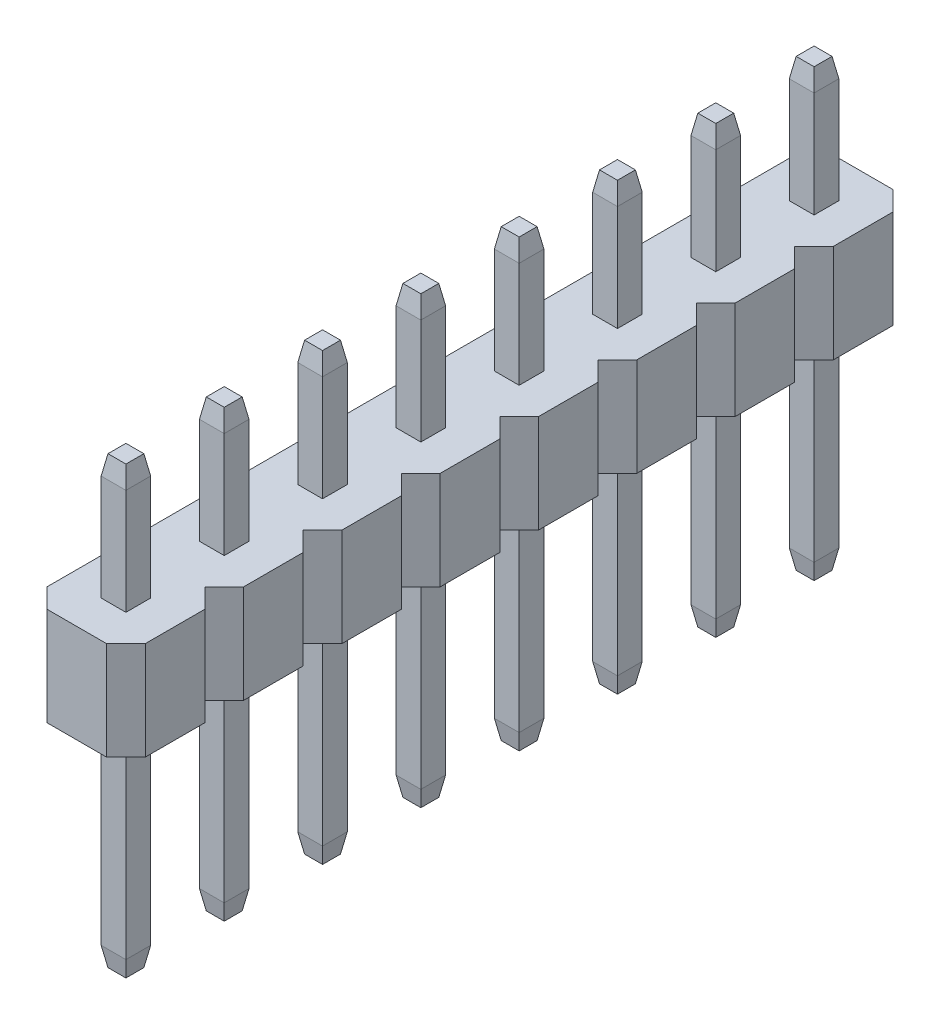
from build123d import *
from OCP.BRepFilletAPI import BRepFilletAPI_MakeChamfer

# Parameters (mm, degrees)
BOSS_EXTRUDE1_DEPTH         = 1.27
BOSS_EXTRUDE2_START         = -7
SKETCH2_W                   = 0.64
SKETCH2_H                   = 0.64
BOSS_EXTRUDE2_DEPTH         = 11.5
CHAMFER1_SIZE               = 0.5
CHAMFER1_SIZE2              = 0.08816349
LPATTERN1_COUNT             = 8
LPATTERN1_PITCH             = 2.54
CHAMFER1_OF_LPATTERN1_SIZE  = 0.5
CHAMFER1_OF_LPATTERN1_SIZE2 = 0.08816349


with BuildPart() as part:
    # Sketch1 → Boss-Extrude1 (new, symmetric)
    with BuildSketch(Plane(origin=(0, 0, 0), x_dir=(1, 0, 0), z_dir=(0, 1, 0))):
        Polygon((-0.77, -1.27), (-1.27, -0.77), (-1.27, 0.77), (-0.77, 1.27), (0.77, 1.27), (1.27, 0.77), (1.27, -0.77), (0.77, -1.27), align=None)
    boss_extrude1 = extrude(amount=BOSS_EXTRUDE1_DEPTH, both=True)

    # Sketch2 → Boss-Extrude2 (add)
    with BuildSketch(Plane(origin=(0, 0, 0), x_dir=(1, 0, 0), z_dir=(0, 1, 0)).offset(BOSS_EXTRUDE2_START)):
        Rectangle(SKETCH2_W, SKETCH2_H)
    boss_extrude2 = extrude(amount=BOSS_EXTRUDE2_DEPTH)

    # Chamfer1: one chamfer whose edges measure the first distance from different faces: ONE call of the kernel's chamfer builder (chamfer() names one face for all edges)
    chamfer1_edges_1 = [part.edges().sort_by_distance(p)[0] for p in [
        (-0.32, -7, 0),
    ]]
    chamfer1_side_1 = [part.faces().sort_by_distance(p)[0] for p in [
        (-0.32, -4.135, 0),
    ]]
    chamfer1_edges_2 = [part.edges().sort_by_distance(p)[0] for p in [
        (0, -7, -0.32),
    ]]
    chamfer1_side_2 = [part.faces().sort_by_distance(p)[0] for p in [
        (0, -4.135, -0.32),
    ]]
    chamfer1_edges_3 = [part.edges().sort_by_distance(p)[0] for p in [
        (0.32, -7, 0),
    ]]
    chamfer1_side_3 = [part.faces().sort_by_distance(p)[0] for p in [
        (0.32, -4.135, 0),
    ]]
    chamfer1_edges_4 = [part.edges().sort_by_distance(p)[0] for p in [
        (0, -7, 0.32),
    ]]
    chamfer1_side_4 = [part.faces().sort_by_distance(p)[0] for p in [
        (0, -4.135, 0.32),
    ]]
    chamfer1_edges_5 = [part.edges().sort_by_distance(p)[0] for p in [
        (-0.32, 4.5, 0),
    ]]
    chamfer1_side_5 = [part.faces().sort_by_distance(p)[0] for p in [
        (-0.32, 2.885, 0),
    ]]
    chamfer1_edges_6 = [part.edges().sort_by_distance(p)[0] for p in [
        (0, 4.5, 0.32),
    ]]
    chamfer1_side_6 = [part.faces().sort_by_distance(p)[0] for p in [
        (0, 2.885, 0.32),
    ]]
    chamfer1_edges_7 = [part.edges().sort_by_distance(p)[0] for p in [
        (0.32, 4.5, 0),
    ]]
    chamfer1_side_7 = [part.faces().sort_by_distance(p)[0] for p in [
        (0.32, 2.885, 0),
    ]]
    chamfer1_edges_8 = [part.edges().sort_by_distance(p)[0] for p in [
        (0, 4.5, -0.32),
    ]]
    chamfer1_side_8 = [part.faces().sort_by_distance(p)[0] for p in [
        (0, 2.885, -0.32),
    ]]
    chamfer1 = BRepFilletAPI_MakeChamfer(part.part.solid().wrapped)
    for e in chamfer1_edges_1:
        chamfer1.Add(CHAMFER1_SIZE, CHAMFER1_SIZE2, e.wrapped, chamfer1_side_1[0].wrapped)  # the first distance lies on this face
    for e in chamfer1_edges_2:
        chamfer1.Add(CHAMFER1_SIZE, CHAMFER1_SIZE2, e.wrapped, chamfer1_side_2[0].wrapped)  # the first distance lies on this face
    for e in chamfer1_edges_3:
        chamfer1.Add(CHAMFER1_SIZE, CHAMFER1_SIZE2, e.wrapped, chamfer1_side_3[0].wrapped)  # the first distance lies on this face
    for e in chamfer1_edges_4:
        chamfer1.Add(CHAMFER1_SIZE, CHAMFER1_SIZE2, e.wrapped, chamfer1_side_4[0].wrapped)  # the first distance lies on this face
    for e in chamfer1_edges_5:
        chamfer1.Add(CHAMFER1_SIZE, CHAMFER1_SIZE2, e.wrapped, chamfer1_side_5[0].wrapped)  # the first distance lies on this face
    for e in chamfer1_edges_6:
        chamfer1.Add(CHAMFER1_SIZE, CHAMFER1_SIZE2, e.wrapped, chamfer1_side_6[0].wrapped)  # the first distance lies on this face
    for e in chamfer1_edges_7:
        chamfer1.Add(CHAMFER1_SIZE, CHAMFER1_SIZE2, e.wrapped, chamfer1_side_7[0].wrapped)  # the first distance lies on this face
    for e in chamfer1_edges_8:
        chamfer1.Add(CHAMFER1_SIZE, CHAMFER1_SIZE2, e.wrapped, chamfer1_side_8[0].wrapped)  # the first distance lies on this face
    add(Compound.cast(chamfer1.Shape()), mode=Mode.REPLACE)

    # LPattern1: Boss-Extrude1, Boss-Extrude2 ×8
    with Locations(*[(0, 0, -i * LPATTERN1_PITCH) for i in range(1, LPATTERN1_COUNT)]):
        add(boss_extrude1)
        add(boss_extrude2)

    # Chamfer1 of LPattern1: one chamfer whose edges measure the first distance from different faces: ONE call of the kernel's chamfer builder (chamfer() names one face for all edges)
    chamfer1_of_lpattern1_edges_1 = [part.edges().sort_by_distance(p)[0] for p in [
        (-0.32, -7, -2.54),
    ]]
    chamfer1_of_lpattern1_side_1 = [part.faces().sort_by_distance(p)[0] for p in [
        (-0.32, -4.135, -2.54),
    ]]
    chamfer1_of_lpattern1_edges_2 = [part.edges().sort_by_distance(p)[0] for p in [
        (0, -7, -2.86),
    ]]
    chamfer1_of_lpattern1_side_2 = [part.faces().sort_by_distance(p)[0] for p in [
        (0, -4.135, -2.86),
    ]]
    chamfer1_of_lpattern1_edges_3 = [part.edges().sort_by_distance(p)[0] for p in [
        (0.32, -7, -2.54),
    ]]
    chamfer1_of_lpattern1_side_3 = [part.faces().sort_by_distance(p)[0] for p in [
        (0.32, -4.135, -2.54),
    ]]
    chamfer1_of_lpattern1_edges_4 = [part.edges().sort_by_distance(p)[0] for p in [
        (0, -7, -2.22),
    ]]
    chamfer1_of_lpattern1_side_4 = [part.faces().sort_by_distance(p)[0] for p in [
        (0, -4.135, -2.22),
    ]]
    chamfer1_of_lpattern1_edges_5 = [part.edges().sort_by_distance(p)[0] for p in [
        (-0.32, 4.5, -2.54),
    ]]
    chamfer1_of_lpattern1_side_5 = [part.faces().sort_by_distance(p)[0] for p in [
        (-0.32, 2.885, -2.54),
    ]]
    chamfer1_of_lpattern1_edges_6 = [part.edges().sort_by_distance(p)[0] for p in [
        (0, 4.5, -2.22),
    ]]
    chamfer1_of_lpattern1_side_6 = [part.faces().sort_by_distance(p)[0] for p in [
        (0, 2.885, -2.22),
    ]]
    chamfer1_of_lpattern1_edges_7 = [part.edges().sort_by_distance(p)[0] for p in [
        (0.32, 4.5, -2.54),
    ]]
    chamfer1_of_lpattern1_side_7 = [part.faces().sort_by_distance(p)[0] for p in [
        (0.32, 2.885, -2.54),
    ]]
    chamfer1_of_lpattern1_edges_8 = [part.edges().sort_by_distance(p)[0] for p in [
        (0, 4.5, -2.86),
    ]]
    chamfer1_of_lpattern1_side_8 = [part.faces().sort_by_distance(p)[0] for p in [
        (0, 2.885, -2.86),
    ]]
    chamfer1_of_lpattern1_edges_9 = [part.edges().sort_by_distance(p)[0] for p in [
        (-0.32, -7, -5.08),
    ]]
    chamfer1_of_lpattern1_side_9 = [part.faces().sort_by_distance(p)[0] for p in [
        (-0.32, -4.135, -5.08),
    ]]
    chamfer1_of_lpattern1_edges_10 = [part.edges().sort_by_distance(p)[0] for p in [
        (0, -7, -5.4),
    ]]
    chamfer1_of_lpattern1_side_10 = [part.faces().sort_by_distance(p)[0] for p in [
        (0, -4.135, -5.4),
    ]]
    chamfer1_of_lpattern1_edges_11 = [part.edges().sort_by_distance(p)[0] for p in [
        (0.32, -7, -5.08),
    ]]
    chamfer1_of_lpattern1_side_11 = [part.faces().sort_by_distance(p)[0] for p in [
        (0.32, -4.135, -5.08),
    ]]
    chamfer1_of_lpattern1_edges_12 = [part.edges().sort_by_distance(p)[0] for p in [
        (0, -7, -4.76),
    ]]
    chamfer1_of_lpattern1_side_12 = [part.faces().sort_by_distance(p)[0] for p in [
        (0, -4.135, -4.76),
    ]]
    chamfer1_of_lpattern1_edges_13 = [part.edges().sort_by_distance(p)[0] for p in [
        (-0.32, 4.5, -5.08),
    ]]
    chamfer1_of_lpattern1_side_13 = [part.faces().sort_by_distance(p)[0] for p in [
        (-0.32, 2.885, -5.08),
    ]]
    chamfer1_of_lpattern1_edges_14 = [part.edges().sort_by_distance(p)[0] for p in [
        (0, 4.5, -4.76),
    ]]
    chamfer1_of_lpattern1_side_14 = [part.faces().sort_by_distance(p)[0] for p in [
        (0, 2.885, -4.76),
    ]]
    chamfer1_of_lpattern1_edges_15 = [part.edges().sort_by_distance(p)[0] for p in [
        (0.32, 4.5, -5.08),
    ]]
    chamfer1_of_lpattern1_side_15 = [part.faces().sort_by_distance(p)[0] for p in [
        (0.32, 2.885, -5.08),
    ]]
    chamfer1_of_lpattern1_edges_16 = [part.edges().sort_by_distance(p)[0] for p in [
        (0, 4.5, -5.4),
    ]]
    chamfer1_of_lpattern1_side_16 = [part.faces().sort_by_distance(p)[0] for p in [
        (0, 2.885, -5.4),
    ]]
    chamfer1_of_lpattern1_edges_17 = [part.edges().sort_by_distance(p)[0] for p in [
        (-0.32, -7, -7.62),
    ]]
    chamfer1_of_lpattern1_side_17 = [part.faces().sort_by_distance(p)[0] for p in [
        (-0.32, -4.135, -7.62),
    ]]
    chamfer1_of_lpattern1_edges_18 = [part.edges().sort_by_distance(p)[0] for p in [
        (0, -7, -7.94),
    ]]
    chamfer1_of_lpattern1_side_18 = [part.faces().sort_by_distance(p)[0] for p in [
        (0, -4.135, -7.94),
    ]]
    chamfer1_of_lpattern1_edges_19 = [part.edges().sort_by_distance(p)[0] for p in [
        (0.32, -7, -7.62),
    ]]
    chamfer1_of_lpattern1_side_19 = [part.faces().sort_by_distance(p)[0] for p in [
        (0.32, -4.135, -7.62),
    ]]
    chamfer1_of_lpattern1_edges_20 = [part.edges().sort_by_distance(p)[0] for p in [
        (0, -7, -7.3),
    ]]
    chamfer1_of_lpattern1_side_20 = [part.faces().sort_by_distance(p)[0] for p in [
        (0, -4.135, -7.3),
    ]]
    chamfer1_of_lpattern1_edges_21 = [part.edges().sort_by_distance(p)[0] for p in [
        (-0.32, 4.5, -7.62),
    ]]
    chamfer1_of_lpattern1_side_21 = [part.faces().sort_by_distance(p)[0] for p in [
        (-0.32, 2.885, -7.62),
    ]]
    chamfer1_of_lpattern1_edges_22 = [part.edges().sort_by_distance(p)[0] for p in [
        (0, 4.5, -7.3),
    ]]
    chamfer1_of_lpattern1_side_22 = [part.faces().sort_by_distance(p)[0] for p in [
        (0, 2.885, -7.3),
    ]]
    chamfer1_of_lpattern1_edges_23 = [part.edges().sort_by_distance(p)[0] for p in [
        (0.32, 4.5, -7.62),
    ]]
    chamfer1_of_lpattern1_side_23 = [part.faces().sort_by_distance(p)[0] for p in [
        (0.32, 2.885, -7.62),
    ]]
    chamfer1_of_lpattern1_edges_24 = [part.edges().sort_by_distance(p)[0] for p in [
        (0, 4.5, -7.94),
    ]]
    chamfer1_of_lpattern1_side_24 = [part.faces().sort_by_distance(p)[0] for p in [
        (0, 2.885, -7.94),
    ]]
    chamfer1_of_lpattern1_edges_25 = [part.edges().sort_by_distance(p)[0] for p in [
        (-0.32, -7, -10.16),
    ]]
    chamfer1_of_lpattern1_side_25 = [part.faces().sort_by_distance(p)[0] for p in [
        (-0.32, -4.135, -10.16),
    ]]
    chamfer1_of_lpattern1_edges_26 = [part.edges().sort_by_distance(p)[0] for p in [
        (0, -7, -10.48),
    ]]
    chamfer1_of_lpattern1_side_26 = [part.faces().sort_by_distance(p)[0] for p in [
        (0, -4.135, -10.48),
    ]]
    chamfer1_of_lpattern1_edges_27 = [part.edges().sort_by_distance(p)[0] for p in [
        (0.32, -7, -10.16),
    ]]
    chamfer1_of_lpattern1_side_27 = [part.faces().sort_by_distance(p)[0] for p in [
        (0.32, -4.135, -10.16),
    ]]
    chamfer1_of_lpattern1_edges_28 = [part.edges().sort_by_distance(p)[0] for p in [
        (0, -7, -9.84),
    ]]
    chamfer1_of_lpattern1_side_28 = [part.faces().sort_by_distance(p)[0] for p in [
        (0, -4.135, -9.84),
    ]]
    chamfer1_of_lpattern1_edges_29 = [part.edges().sort_by_distance(p)[0] for p in [
        (-0.32, 4.5, -10.16),
    ]]
    chamfer1_of_lpattern1_side_29 = [part.faces().sort_by_distance(p)[0] for p in [
        (-0.32, 2.885, -10.16),
    ]]
    chamfer1_of_lpattern1_edges_30 = [part.edges().sort_by_distance(p)[0] for p in [
        (0, 4.5, -9.84),
    ]]
    chamfer1_of_lpattern1_side_30 = [part.faces().sort_by_distance(p)[0] for p in [
        (0, 2.885, -9.84),
    ]]
    chamfer1_of_lpattern1_edges_31 = [part.edges().sort_by_distance(p)[0] for p in [
        (0.32, 4.5, -10.16),
    ]]
    chamfer1_of_lpattern1_side_31 = [part.faces().sort_by_distance(p)[0] for p in [
        (0.32, 2.885, -10.16),
    ]]
    chamfer1_of_lpattern1_edges_32 = [part.edges().sort_by_distance(p)[0] for p in [
        (0, 4.5, -10.48),
    ]]
    chamfer1_of_lpattern1_side_32 = [part.faces().sort_by_distance(p)[0] for p in [
        (0, 2.885, -10.48),
    ]]
    chamfer1_of_lpattern1_edges_33 = [part.edges().sort_by_distance(p)[0] for p in [
        (-0.32, -7, -12.7),
    ]]
    chamfer1_of_lpattern1_side_33 = [part.faces().sort_by_distance(p)[0] for p in [
        (-0.32, -4.135, -12.7),
    ]]
    chamfer1_of_lpattern1_edges_34 = [part.edges().sort_by_distance(p)[0] for p in [
        (0, -7, -13.02),
    ]]
    chamfer1_of_lpattern1_side_34 = [part.faces().sort_by_distance(p)[0] for p in [
        (0, -4.135, -13.02),
    ]]
    chamfer1_of_lpattern1_edges_35 = [part.edges().sort_by_distance(p)[0] for p in [
        (0.32, -7, -12.7),
    ]]
    chamfer1_of_lpattern1_side_35 = [part.faces().sort_by_distance(p)[0] for p in [
        (0.32, -4.135, -12.7),
    ]]
    chamfer1_of_lpattern1_edges_36 = [part.edges().sort_by_distance(p)[0] for p in [
        (0, -7, -12.38),
    ]]
    chamfer1_of_lpattern1_side_36 = [part.faces().sort_by_distance(p)[0] for p in [
        (0, -4.135, -12.38),
    ]]
    chamfer1_of_lpattern1_edges_37 = [part.edges().sort_by_distance(p)[0] for p in [
        (-0.32, 4.5, -12.7),
    ]]
    chamfer1_of_lpattern1_side_37 = [part.faces().sort_by_distance(p)[0] for p in [
        (-0.32, 2.885, -12.7),
    ]]
    chamfer1_of_lpattern1_edges_38 = [part.edges().sort_by_distance(p)[0] for p in [
        (0, 4.5, -12.38),
    ]]
    chamfer1_of_lpattern1_side_38 = [part.faces().sort_by_distance(p)[0] for p in [
        (0, 2.885, -12.38),
    ]]
    chamfer1_of_lpattern1_edges_39 = [part.edges().sort_by_distance(p)[0] for p in [
        (0.32, 4.5, -12.7),
    ]]
    chamfer1_of_lpattern1_side_39 = [part.faces().sort_by_distance(p)[0] for p in [
        (0.32, 2.885, -12.7),
    ]]
    chamfer1_of_lpattern1_edges_40 = [part.edges().sort_by_distance(p)[0] for p in [
        (0, 4.5, -13.02),
    ]]
    chamfer1_of_lpattern1_side_40 = [part.faces().sort_by_distance(p)[0] for p in [
        (0, 2.885, -13.02),
    ]]
    chamfer1_of_lpattern1_edges_41 = [part.edges().sort_by_distance(p)[0] for p in [
        (-0.32, -7, -15.24),
    ]]
    chamfer1_of_lpattern1_side_41 = [part.faces().sort_by_distance(p)[0] for p in [
        (-0.32, -4.135, -15.24),
    ]]
    chamfer1_of_lpattern1_edges_42 = [part.edges().sort_by_distance(p)[0] for p in [
        (0, -7, -15.56),
    ]]
    chamfer1_of_lpattern1_side_42 = [part.faces().sort_by_distance(p)[0] for p in [
        (0, -4.135, -15.56),
    ]]
    chamfer1_of_lpattern1_edges_43 = [part.edges().sort_by_distance(p)[0] for p in [
        (0.32, -7, -15.24),
    ]]
    chamfer1_of_lpattern1_side_43 = [part.faces().sort_by_distance(p)[0] for p in [
        (0.32, -4.135, -15.24),
    ]]
    chamfer1_of_lpattern1_edges_44 = [part.edges().sort_by_distance(p)[0] for p in [
        (0, -7, -14.92),
    ]]
    chamfer1_of_lpattern1_side_44 = [part.faces().sort_by_distance(p)[0] for p in [
        (0, -4.135, -14.92),
    ]]
    chamfer1_of_lpattern1_edges_45 = [part.edges().sort_by_distance(p)[0] for p in [
        (-0.32, 4.5, -15.24),
    ]]
    chamfer1_of_lpattern1_side_45 = [part.faces().sort_by_distance(p)[0] for p in [
        (-0.32, 2.885, -15.24),
    ]]
    chamfer1_of_lpattern1_edges_46 = [part.edges().sort_by_distance(p)[0] for p in [
        (0, 4.5, -14.92),
    ]]
    chamfer1_of_lpattern1_side_46 = [part.faces().sort_by_distance(p)[0] for p in [
        (0, 2.885, -14.92),
    ]]
    chamfer1_of_lpattern1_edges_47 = [part.edges().sort_by_distance(p)[0] for p in [
        (0.32, 4.5, -15.24),
    ]]
    chamfer1_of_lpattern1_side_47 = [part.faces().sort_by_distance(p)[0] for p in [
        (0.32, 2.885, -15.24),
    ]]
    chamfer1_of_lpattern1_edges_48 = [part.edges().sort_by_distance(p)[0] for p in [
        (0, 4.5, -15.56),
    ]]
    chamfer1_of_lpattern1_side_48 = [part.faces().sort_by_distance(p)[0] for p in [
        (0, 2.885, -15.56),
    ]]
    chamfer1_of_lpattern1_edges_49 = [part.edges().sort_by_distance(p)[0] for p in [
        (-0.32, -7, -17.78),
    ]]
    chamfer1_of_lpattern1_side_49 = [part.faces().sort_by_distance(p)[0] for p in [
        (-0.32, -4.135, -17.78),
    ]]
    chamfer1_of_lpattern1_edges_50 = [part.edges().sort_by_distance(p)[0] for p in [
        (0, -7, -18.1),
    ]]
    chamfer1_of_lpattern1_side_50 = [part.faces().sort_by_distance(p)[0] for p in [
        (0, -4.135, -18.1),
    ]]
    chamfer1_of_lpattern1_edges_51 = [part.edges().sort_by_distance(p)[0] for p in [
        (0.32, -7, -17.78),
    ]]
    chamfer1_of_lpattern1_side_51 = [part.faces().sort_by_distance(p)[0] for p in [
        (0.32, -4.135, -17.78),
    ]]
    chamfer1_of_lpattern1_edges_52 = [part.edges().sort_by_distance(p)[0] for p in [
        (0, -7, -17.46),
    ]]
    chamfer1_of_lpattern1_side_52 = [part.faces().sort_by_distance(p)[0] for p in [
        (0, -4.135, -17.46),
    ]]
    chamfer1_of_lpattern1_edges_53 = [part.edges().sort_by_distance(p)[0] for p in [
        (-0.32, 4.5, -17.78),
    ]]
    chamfer1_of_lpattern1_side_53 = [part.faces().sort_by_distance(p)[0] for p in [
        (-0.32, 2.885, -17.78),
    ]]
    chamfer1_of_lpattern1_edges_54 = [part.edges().sort_by_distance(p)[0] for p in [
        (0, 4.5, -17.46),
    ]]
    chamfer1_of_lpattern1_side_54 = [part.faces().sort_by_distance(p)[0] for p in [
        (0, 2.885, -17.46),
    ]]
    chamfer1_of_lpattern1_edges_55 = [part.edges().sort_by_distance(p)[0] for p in [
        (0.32, 4.5, -17.78),
    ]]
    chamfer1_of_lpattern1_side_55 = [part.faces().sort_by_distance(p)[0] for p in [
        (0.32, 2.885, -17.78),
    ]]
    chamfer1_of_lpattern1_edges_56 = [part.edges().sort_by_distance(p)[0] for p in [
        (0, 4.5, -18.1),
    ]]
    chamfer1_of_lpattern1_side_56 = [part.faces().sort_by_distance(p)[0] for p in [
        (0, 2.885, -18.1),
    ]]
    chamfer1_of_lpattern1 = BRepFilletAPI_MakeChamfer(part.part.solid().wrapped)
    for e in chamfer1_of_lpattern1_edges_1:
        chamfer1_of_lpattern1.Add(CHAMFER1_OF_LPATTERN1_SIZE, CHAMFER1_OF_LPATTERN1_SIZE2, e.wrapped, chamfer1_of_lpattern1_side_1[0].wrapped)  # the first distance lies on this face
    for e in chamfer1_of_lpattern1_edges_2:
        chamfer1_of_lpattern1.Add(CHAMFER1_OF_LPATTERN1_SIZE, CHAMFER1_OF_LPATTERN1_SIZE2, e.wrapped, chamfer1_of_lpattern1_side_2[0].wrapped)  # the first distance lies on this face
    for e in chamfer1_of_lpattern1_edges_3:
        chamfer1_of_lpattern1.Add(CHAMFER1_OF_LPATTERN1_SIZE, CHAMFER1_OF_LPATTERN1_SIZE2, e.wrapped, chamfer1_of_lpattern1_side_3[0].wrapped)  # the first distance lies on this face
    for e in chamfer1_of_lpattern1_edges_4:
        chamfer1_of_lpattern1.Add(CHAMFER1_OF_LPATTERN1_SIZE, CHAMFER1_OF_LPATTERN1_SIZE2, e.wrapped, chamfer1_of_lpattern1_side_4[0].wrapped)  # the first distance lies on this face
    for e in chamfer1_of_lpattern1_edges_5:
        chamfer1_of_lpattern1.Add(CHAMFER1_OF_LPATTERN1_SIZE, CHAMFER1_OF_LPATTERN1_SIZE2, e.wrapped, chamfer1_of_lpattern1_side_5[0].wrapped)  # the first distance lies on this face
    for e in chamfer1_of_lpattern1_edges_6:
        chamfer1_of_lpattern1.Add(CHAMFER1_OF_LPATTERN1_SIZE, CHAMFER1_OF_LPATTERN1_SIZE2, e.wrapped, chamfer1_of_lpattern1_side_6[0].wrapped)  # the first distance lies on this face
    for e in chamfer1_of_lpattern1_edges_7:
        chamfer1_of_lpattern1.Add(CHAMFER1_OF_LPATTERN1_SIZE, CHAMFER1_OF_LPATTERN1_SIZE2, e.wrapped, chamfer1_of_lpattern1_side_7[0].wrapped)  # the first distance lies on this face
    for e in chamfer1_of_lpattern1_edges_8:
        chamfer1_of_lpattern1.Add(CHAMFER1_OF_LPATTERN1_SIZE, CHAMFER1_OF_LPATTERN1_SIZE2, e.wrapped, chamfer1_of_lpattern1_side_8[0].wrapped)  # the first distance lies on this face
    for e in chamfer1_of_lpattern1_edges_9:
        chamfer1_of_lpattern1.Add(CHAMFER1_OF_LPATTERN1_SIZE, CHAMFER1_OF_LPATTERN1_SIZE2, e.wrapped, chamfer1_of_lpattern1_side_9[0].wrapped)  # the first distance lies on this face
    for e in chamfer1_of_lpattern1_edges_10:
        chamfer1_of_lpattern1.Add(CHAMFER1_OF_LPATTERN1_SIZE, CHAMFER1_OF_LPATTERN1_SIZE2, e.wrapped, chamfer1_of_lpattern1_side_10[0].wrapped)  # the first distance lies on this face
    for e in chamfer1_of_lpattern1_edges_11:
        chamfer1_of_lpattern1.Add(CHAMFER1_OF_LPATTERN1_SIZE, CHAMFER1_OF_LPATTERN1_SIZE2, e.wrapped, chamfer1_of_lpattern1_side_11[0].wrapped)  # the first distance lies on this face
    for e in chamfer1_of_lpattern1_edges_12:
        chamfer1_of_lpattern1.Add(CHAMFER1_OF_LPATTERN1_SIZE, CHAMFER1_OF_LPATTERN1_SIZE2, e.wrapped, chamfer1_of_lpattern1_side_12[0].wrapped)  # the first distance lies on this face
    for e in chamfer1_of_lpattern1_edges_13:
        chamfer1_of_lpattern1.Add(CHAMFER1_OF_LPATTERN1_SIZE, CHAMFER1_OF_LPATTERN1_SIZE2, e.wrapped, chamfer1_of_lpattern1_side_13[0].wrapped)  # the first distance lies on this face
    for e in chamfer1_of_lpattern1_edges_14:
        chamfer1_of_lpattern1.Add(CHAMFER1_OF_LPATTERN1_SIZE, CHAMFER1_OF_LPATTERN1_SIZE2, e.wrapped, chamfer1_of_lpattern1_side_14[0].wrapped)  # the first distance lies on this face
    for e in chamfer1_of_lpattern1_edges_15:
        chamfer1_of_lpattern1.Add(CHAMFER1_OF_LPATTERN1_SIZE, CHAMFER1_OF_LPATTERN1_SIZE2, e.wrapped, chamfer1_of_lpattern1_side_15[0].wrapped)  # the first distance lies on this face
    for e in chamfer1_of_lpattern1_edges_16:
        chamfer1_of_lpattern1.Add(CHAMFER1_OF_LPATTERN1_SIZE, CHAMFER1_OF_LPATTERN1_SIZE2, e.wrapped, chamfer1_of_lpattern1_side_16[0].wrapped)  # the first distance lies on this face
    for e in chamfer1_of_lpattern1_edges_17:
        chamfer1_of_lpattern1.Add(CHAMFER1_OF_LPATTERN1_SIZE, CHAMFER1_OF_LPATTERN1_SIZE2, e.wrapped, chamfer1_of_lpattern1_side_17[0].wrapped)  # the first distance lies on this face
    for e in chamfer1_of_lpattern1_edges_18:
        chamfer1_of_lpattern1.Add(CHAMFER1_OF_LPATTERN1_SIZE, CHAMFER1_OF_LPATTERN1_SIZE2, e.wrapped, chamfer1_of_lpattern1_side_18[0].wrapped)  # the first distance lies on this face
    for e in chamfer1_of_lpattern1_edges_19:
        chamfer1_of_lpattern1.Add(CHAMFER1_OF_LPATTERN1_SIZE, CHAMFER1_OF_LPATTERN1_SIZE2, e.wrapped, chamfer1_of_lpattern1_side_19[0].wrapped)  # the first distance lies on this face
    for e in chamfer1_of_lpattern1_edges_20:
        chamfer1_of_lpattern1.Add(CHAMFER1_OF_LPATTERN1_SIZE, CHAMFER1_OF_LPATTERN1_SIZE2, e.wrapped, chamfer1_of_lpattern1_side_20[0].wrapped)  # the first distance lies on this face
    for e in chamfer1_of_lpattern1_edges_21:
        chamfer1_of_lpattern1.Add(CHAMFER1_OF_LPATTERN1_SIZE, CHAMFER1_OF_LPATTERN1_SIZE2, e.wrapped, chamfer1_of_lpattern1_side_21[0].wrapped)  # the first distance lies on this face
    for e in chamfer1_of_lpattern1_edges_22:
        chamfer1_of_lpattern1.Add(CHAMFER1_OF_LPATTERN1_SIZE, CHAMFER1_OF_LPATTERN1_SIZE2, e.wrapped, chamfer1_of_lpattern1_side_22[0].wrapped)  # the first distance lies on this face
    for e in chamfer1_of_lpattern1_edges_23:
        chamfer1_of_lpattern1.Add(CHAMFER1_OF_LPATTERN1_SIZE, CHAMFER1_OF_LPATTERN1_SIZE2, e.wrapped, chamfer1_of_lpattern1_side_23[0].wrapped)  # the first distance lies on this face
    for e in chamfer1_of_lpattern1_edges_24:
        chamfer1_of_lpattern1.Add(CHAMFER1_OF_LPATTERN1_SIZE, CHAMFER1_OF_LPATTERN1_SIZE2, e.wrapped, chamfer1_of_lpattern1_side_24[0].wrapped)  # the first distance lies on this face
    for e in chamfer1_of_lpattern1_edges_25:
        chamfer1_of_lpattern1.Add(CHAMFER1_OF_LPATTERN1_SIZE, CHAMFER1_OF_LPATTERN1_SIZE2, e.wrapped, chamfer1_of_lpattern1_side_25[0].wrapped)  # the first distance lies on this face
    for e in chamfer1_of_lpattern1_edges_26:
        chamfer1_of_lpattern1.Add(CHAMFER1_OF_LPATTERN1_SIZE, CHAMFER1_OF_LPATTERN1_SIZE2, e.wrapped, chamfer1_of_lpattern1_side_26[0].wrapped)  # the first distance lies on this face
    for e in chamfer1_of_lpattern1_edges_27:
        chamfer1_of_lpattern1.Add(CHAMFER1_OF_LPATTERN1_SIZE, CHAMFER1_OF_LPATTERN1_SIZE2, e.wrapped, chamfer1_of_lpattern1_side_27[0].wrapped)  # the first distance lies on this face
    for e in chamfer1_of_lpattern1_edges_28:
        chamfer1_of_lpattern1.Add(CHAMFER1_OF_LPATTERN1_SIZE, CHAMFER1_OF_LPATTERN1_SIZE2, e.wrapped, chamfer1_of_lpattern1_side_28[0].wrapped)  # the first distance lies on this face
    for e in chamfer1_of_lpattern1_edges_29:
        chamfer1_of_lpattern1.Add(CHAMFER1_OF_LPATTERN1_SIZE, CHAMFER1_OF_LPATTERN1_SIZE2, e.wrapped, chamfer1_of_lpattern1_side_29[0].wrapped)  # the first distance lies on this face
    for e in chamfer1_of_lpattern1_edges_30:
        chamfer1_of_lpattern1.Add(CHAMFER1_OF_LPATTERN1_SIZE, CHAMFER1_OF_LPATTERN1_SIZE2, e.wrapped, chamfer1_of_lpattern1_side_30[0].wrapped)  # the first distance lies on this face
    for e in chamfer1_of_lpattern1_edges_31:
        chamfer1_of_lpattern1.Add(CHAMFER1_OF_LPATTERN1_SIZE, CHAMFER1_OF_LPATTERN1_SIZE2, e.wrapped, chamfer1_of_lpattern1_side_31[0].wrapped)  # the first distance lies on this face
    for e in chamfer1_of_lpattern1_edges_32:
        chamfer1_of_lpattern1.Add(CHAMFER1_OF_LPATTERN1_SIZE, CHAMFER1_OF_LPATTERN1_SIZE2, e.wrapped, chamfer1_of_lpattern1_side_32[0].wrapped)  # the first distance lies on this face
    for e in chamfer1_of_lpattern1_edges_33:
        chamfer1_of_lpattern1.Add(CHAMFER1_OF_LPATTERN1_SIZE, CHAMFER1_OF_LPATTERN1_SIZE2, e.wrapped, chamfer1_of_lpattern1_side_33[0].wrapped)  # the first distance lies on this face
    for e in chamfer1_of_lpattern1_edges_34:
        chamfer1_of_lpattern1.Add(CHAMFER1_OF_LPATTERN1_SIZE, CHAMFER1_OF_LPATTERN1_SIZE2, e.wrapped, chamfer1_of_lpattern1_side_34[0].wrapped)  # the first distance lies on this face
    for e in chamfer1_of_lpattern1_edges_35:
        chamfer1_of_lpattern1.Add(CHAMFER1_OF_LPATTERN1_SIZE, CHAMFER1_OF_LPATTERN1_SIZE2, e.wrapped, chamfer1_of_lpattern1_side_35[0].wrapped)  # the first distance lies on this face
    for e in chamfer1_of_lpattern1_edges_36:
        chamfer1_of_lpattern1.Add(CHAMFER1_OF_LPATTERN1_SIZE, CHAMFER1_OF_LPATTERN1_SIZE2, e.wrapped, chamfer1_of_lpattern1_side_36[0].wrapped)  # the first distance lies on this face
    for e in chamfer1_of_lpattern1_edges_37:
        chamfer1_of_lpattern1.Add(CHAMFER1_OF_LPATTERN1_SIZE, CHAMFER1_OF_LPATTERN1_SIZE2, e.wrapped, chamfer1_of_lpattern1_side_37[0].wrapped)  # the first distance lies on this face
    for e in chamfer1_of_lpattern1_edges_38:
        chamfer1_of_lpattern1.Add(CHAMFER1_OF_LPATTERN1_SIZE, CHAMFER1_OF_LPATTERN1_SIZE2, e.wrapped, chamfer1_of_lpattern1_side_38[0].wrapped)  # the first distance lies on this face
    for e in chamfer1_of_lpattern1_edges_39:
        chamfer1_of_lpattern1.Add(CHAMFER1_OF_LPATTERN1_SIZE, CHAMFER1_OF_LPATTERN1_SIZE2, e.wrapped, chamfer1_of_lpattern1_side_39[0].wrapped)  # the first distance lies on this face
    for e in chamfer1_of_lpattern1_edges_40:
        chamfer1_of_lpattern1.Add(CHAMFER1_OF_LPATTERN1_SIZE, CHAMFER1_OF_LPATTERN1_SIZE2, e.wrapped, chamfer1_of_lpattern1_side_40[0].wrapped)  # the first distance lies on this face
    for e in chamfer1_of_lpattern1_edges_41:
        chamfer1_of_lpattern1.Add(CHAMFER1_OF_LPATTERN1_SIZE, CHAMFER1_OF_LPATTERN1_SIZE2, e.wrapped, chamfer1_of_lpattern1_side_41[0].wrapped)  # the first distance lies on this face
    for e in chamfer1_of_lpattern1_edges_42:
        chamfer1_of_lpattern1.Add(CHAMFER1_OF_LPATTERN1_SIZE, CHAMFER1_OF_LPATTERN1_SIZE2, e.wrapped, chamfer1_of_lpattern1_side_42[0].wrapped)  # the first distance lies on this face
    for e in chamfer1_of_lpattern1_edges_43:
        chamfer1_of_lpattern1.Add(CHAMFER1_OF_LPATTERN1_SIZE, CHAMFER1_OF_LPATTERN1_SIZE2, e.wrapped, chamfer1_of_lpattern1_side_43[0].wrapped)  # the first distance lies on this face
    for e in chamfer1_of_lpattern1_edges_44:
        chamfer1_of_lpattern1.Add(CHAMFER1_OF_LPATTERN1_SIZE, CHAMFER1_OF_LPATTERN1_SIZE2, e.wrapped, chamfer1_of_lpattern1_side_44[0].wrapped)  # the first distance lies on this face
    for e in chamfer1_of_lpattern1_edges_45:
        chamfer1_of_lpattern1.Add(CHAMFER1_OF_LPATTERN1_SIZE, CHAMFER1_OF_LPATTERN1_SIZE2, e.wrapped, chamfer1_of_lpattern1_side_45[0].wrapped)  # the first distance lies on this face
    for e in chamfer1_of_lpattern1_edges_46:
        chamfer1_of_lpattern1.Add(CHAMFER1_OF_LPATTERN1_SIZE, CHAMFER1_OF_LPATTERN1_SIZE2, e.wrapped, chamfer1_of_lpattern1_side_46[0].wrapped)  # the first distance lies on this face
    for e in chamfer1_of_lpattern1_edges_47:
        chamfer1_of_lpattern1.Add(CHAMFER1_OF_LPATTERN1_SIZE, CHAMFER1_OF_LPATTERN1_SIZE2, e.wrapped, chamfer1_of_lpattern1_side_47[0].wrapped)  # the first distance lies on this face
    for e in chamfer1_of_lpattern1_edges_48:
        chamfer1_of_lpattern1.Add(CHAMFER1_OF_LPATTERN1_SIZE, CHAMFER1_OF_LPATTERN1_SIZE2, e.wrapped, chamfer1_of_lpattern1_side_48[0].wrapped)  # the first distance lies on this face
    for e in chamfer1_of_lpattern1_edges_49:
        chamfer1_of_lpattern1.Add(CHAMFER1_OF_LPATTERN1_SIZE, CHAMFER1_OF_LPATTERN1_SIZE2, e.wrapped, chamfer1_of_lpattern1_side_49[0].wrapped)  # the first distance lies on this face
    for e in chamfer1_of_lpattern1_edges_50:
        chamfer1_of_lpattern1.Add(CHAMFER1_OF_LPATTERN1_SIZE, CHAMFER1_OF_LPATTERN1_SIZE2, e.wrapped, chamfer1_of_lpattern1_side_50[0].wrapped)  # the first distance lies on this face
    for e in chamfer1_of_lpattern1_edges_51:
        chamfer1_of_lpattern1.Add(CHAMFER1_OF_LPATTERN1_SIZE, CHAMFER1_OF_LPATTERN1_SIZE2, e.wrapped, chamfer1_of_lpattern1_side_51[0].wrapped)  # the first distance lies on this face
    for e in chamfer1_of_lpattern1_edges_52:
        chamfer1_of_lpattern1.Add(CHAMFER1_OF_LPATTERN1_SIZE, CHAMFER1_OF_LPATTERN1_SIZE2, e.wrapped, chamfer1_of_lpattern1_side_52[0].wrapped)  # the first distance lies on this face
    for e in chamfer1_of_lpattern1_edges_53:
        chamfer1_of_lpattern1.Add(CHAMFER1_OF_LPATTERN1_SIZE, CHAMFER1_OF_LPATTERN1_SIZE2, e.wrapped, chamfer1_of_lpattern1_side_53[0].wrapped)  # the first distance lies on this face
    for e in chamfer1_of_lpattern1_edges_54:
        chamfer1_of_lpattern1.Add(CHAMFER1_OF_LPATTERN1_SIZE, CHAMFER1_OF_LPATTERN1_SIZE2, e.wrapped, chamfer1_of_lpattern1_side_54[0].wrapped)  # the first distance lies on this face
    for e in chamfer1_of_lpattern1_edges_55:
        chamfer1_of_lpattern1.Add(CHAMFER1_OF_LPATTERN1_SIZE, CHAMFER1_OF_LPATTERN1_SIZE2, e.wrapped, chamfer1_of_lpattern1_side_55[0].wrapped)  # the first distance lies on this face
    for e in chamfer1_of_lpattern1_edges_56:
        chamfer1_of_lpattern1.Add(CHAMFER1_OF_LPATTERN1_SIZE, CHAMFER1_OF_LPATTERN1_SIZE2, e.wrapped, chamfer1_of_lpattern1_side_56[0].wrapped)  # the first distance lies on this face
    add(Compound.cast(chamfer1_of_lpattern1.Shape()), mode=Mode.REPLACE)


solid = part.part
